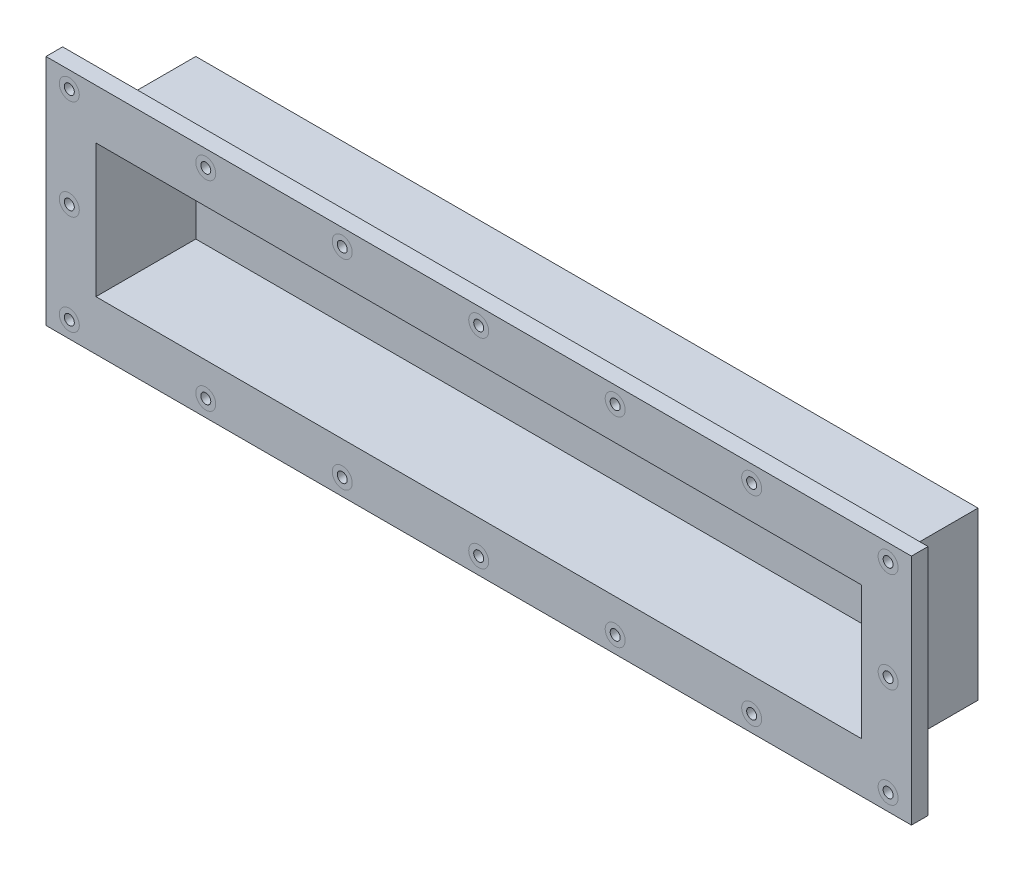
from build123d import *

# Parameters (mm, degrees)
SKETCH_1_W          = 470
SKETCH_1_H          = 100
EXTRUDE_1_DEPTH     = 50
SKETCH_2_W          = 460
SKETCH_2_H          = 80
CUT_EXTRUDE_1_DEPTH = 180
SKETCH_3_W          = 520
SKETCH_3_H          = 140
SKETCH_3_W_2        = 460
SKETCH_3_H_2        = 80
EXTRUDE_2_DEPTH     = 10
SKETCH_4_R          = 6
CUT_EXTRUDE_2_DEPTH = 10
SKETCH_5_R          = 6
SKETCH_5_R_2        = 3
EXTRUDE_3_DEPTH     = 7
EXTRUDE_3_2_DEPTH   = 7
EXTRUDE_3_3_DEPTH   = 7
EXTRUDE_3_4_DEPTH   = 7
EXTRUDE_3_5_DEPTH   = 7
EXTRUDE_3_6_DEPTH   = 7
EXTRUDE_3_7_DEPTH   = 7
EXTRUDE_3_8_DEPTH   = 7
EXTRUDE_3_9_DEPTH   = 7
EXTRUDE_3_10_DEPTH  = 7
EXTRUDE_3_11_DEPTH  = 7
EXTRUDE_3_12_DEPTH  = 7
EXTRUDE_3_13_DEPTH  = 7
EXTRUDE_3_14_DEPTH  = 7
EXTRUDE_3_15_DEPTH  = 7
EXTRUDE_3_16_DEPTH  = 7
SKETCH_6_W          = 470
SKETCH_6_H          = 100
EXTRUDE_4_DEPTH     = 5


with BuildPart() as part:
    # 草图1 → 凸台-拉伸1 (new body)
    with BuildSketch(Plane.XY):
        Rectangle(SKETCH_1_W, SKETCH_1_H)
    extrude(amount=EXTRUDE_1_DEPTH)

    # 草图2 → 切除-拉伸1 (cut)
    with BuildSketch(Plane.XY.offset(50)):
        Rectangle(SKETCH_2_W, SKETCH_2_H)
    extrude(amount=-CUT_EXTRUDE_1_DEPTH, mode=Mode.SUBTRACT)

    # 草图3 → 凸台-拉伸2 (add)
    with BuildSketch(Plane.XY.offset(50)):
        Rectangle(SKETCH_3_W, SKETCH_3_H)
        Rectangle(SKETCH_3_W_2, SKETCH_3_H_2, mode=Mode.SUBTRACT)
    extrude(amount=EXTRUDE_2_DEPTH)

    # 草图4 → 切除-拉伸2 (cut)
    with BuildSketch(Plane.XY.offset(60)):
        with Locations((0, 60)):
            Circle(SKETCH_4_R)
        with Locations((-82, 60)):
            Circle(SKETCH_4_R)
        with Locations((-164, 60)):
            Circle(SKETCH_4_R)
        with Locations((-246, 60)):
            Circle(SKETCH_4_R)
        with Locations(Location((246, 0, 0), (0, 0, 180))):
            Circle(SKETCH_4_R)
        with Locations(Location((246, 60, 0), (0, 0, 180))):
            Circle(SKETCH_4_R)
        with Locations(Location((164, 60, 0), (0, 0, 180))):
            Circle(SKETCH_4_R)
        with Locations(Location((82, 60, 0), (0, 0, 180))):
            Circle(SKETCH_4_R)
        with Locations((-246, 0)):
            Circle(SKETCH_4_R)
        with Locations((82, -60)):
            Circle(SKETCH_4_R)
        with Locations((164, -60)):
            Circle(SKETCH_4_R)
        with Locations((246, -60)):
            Circle(SKETCH_4_R)
        with Locations(Location((-246, -60, 0), (0, 0, 180))):
            Circle(SKETCH_4_R)
        with Locations(Location((-164, -60, 0), (0, 0, 180))):
            Circle(SKETCH_4_R)
        with Locations(Location((-82, -60, 0), (0, 0, 180))):
            Circle(SKETCH_4_R)
        with Locations(Location((0, -60, 0), (0, 0, 180))):
            Circle(SKETCH_4_R)
    extrude(amount=-CUT_EXTRUDE_2_DEPTH, mode=Mode.SUBTRACT)

    # 草图6 → 凸台-拉伸4 (add)
    with BuildSketch(Plane(origin=(0, 0, 0), x_dir=(-1, 0, 0), z_dir=(0, 0, -1))):
        Rectangle(SKETCH_6_W, SKETCH_6_H)
    extrude(amount=EXTRUDE_4_DEPTH)


with BuildPart() as body_2:
    # 草图5 → 凸台-拉伸3 (new body)
    with BuildSketch(Plane.XY.offset(60)):
        with Locations((0, 60)):
            Circle(SKETCH_5_R)
        with Locations((0, 60)):
            Circle(SKETCH_5_R_2, mode=Mode.SUBTRACT)
    extrude(amount=-EXTRUDE_3_DEPTH)


with BuildPart() as body_3:
    # 草图5 → Extrude 3 2 (new body)
    with BuildSketch(Plane.XY.offset(60)):
        with Locations((-82, 60)):
            Circle(SKETCH_5_R)
        with Locations((-82, 60)):
            Circle(SKETCH_5_R_2, mode=Mode.SUBTRACT)
    extrude(amount=-EXTRUDE_3_2_DEPTH)


with BuildPart() as body_4:
    # 草图5 → Extrude 3 3 (new body)
    with BuildSketch(Plane.XY.offset(60)):
        with Locations((-164, 60)):
            Circle(SKETCH_5_R)
        with Locations((-164, 60)):
            Circle(SKETCH_5_R_2, mode=Mode.SUBTRACT)
    extrude(amount=-EXTRUDE_3_3_DEPTH)


with BuildPart() as body_5:
    # 草图5 → Extrude 3 4 (new body)
    with BuildSketch(Plane.XY.offset(60)):
        with Locations((-246, 60)):
            Circle(SKETCH_5_R)
        with Locations((-246, 60)):
            Circle(SKETCH_5_R_2, mode=Mode.SUBTRACT)
    extrude(amount=-EXTRUDE_3_4_DEPTH)


with BuildPart() as body_6:
    # 草图5 → Extrude 3 5 (new body)
    with BuildSketch(Plane.XY.offset(60)):
        with Locations(Location((-246, -60, 0), (0, 0, 180))):
            Circle(SKETCH_5_R)
        with Locations(Location((-246, -60, 0), (0, 0, 180))):
            Circle(SKETCH_5_R_2, mode=Mode.SUBTRACT)
    extrude(amount=-EXTRUDE_3_5_DEPTH)


with BuildPart() as body_7:
    # 草图5 → Extrude 3 6 (new body)
    with BuildSketch(Plane.XY.offset(60)):
        with Locations(Location((-164, -60, 0), (0, 0, 180))):
            Circle(SKETCH_5_R)
        with Locations(Location((-164, -60, 0), (0, 0, 180))):
            Circle(SKETCH_5_R_2, mode=Mode.SUBTRACT)
    extrude(amount=-EXTRUDE_3_6_DEPTH)


with BuildPart() as body_8:
    # 草图5 → Extrude 3 7 (new body)
    with BuildSketch(Plane.XY.offset(60)):
        with Locations(Location((-82, -60, 0), (0, 0, 180))):
            Circle(SKETCH_5_R)
        with Locations(Location((-82, -60, 0), (0, 0, 180))):
            Circle(SKETCH_5_R_2, mode=Mode.SUBTRACT)
    extrude(amount=-EXTRUDE_3_7_DEPTH)


with BuildPart() as body_9:
    # 草图5 → Extrude 3 8 (new body)
    with BuildSketch(Plane.XY.offset(60)):
        with Locations(Location((0, -60, 0), (0, 0, 180))):
            Circle(SKETCH_5_R)
        with Locations(Location((0, -60, 0), (0, 0, 180))):
            Circle(SKETCH_5_R_2, mode=Mode.SUBTRACT)
    extrude(amount=-EXTRUDE_3_8_DEPTH)


with BuildPart() as body_10:
    # 草图5 → Extrude 3 9 (new body)
    with BuildSketch(Plane.XY.offset(60)):
        with Locations((82, -60)):
            Circle(SKETCH_5_R)
        with Locations((82, -60)):
            Circle(SKETCH_5_R_2, mode=Mode.SUBTRACT)
    extrude(amount=-EXTRUDE_3_9_DEPTH)


with BuildPart() as body_11:
    # 草图5 → Extrude 3 10 (new body)
    with BuildSketch(Plane.XY.offset(60)):
        with Locations((164, -60)):
            Circle(SKETCH_5_R)
        with Locations((164, -60)):
            Circle(SKETCH_5_R_2, mode=Mode.SUBTRACT)
    extrude(amount=-EXTRUDE_3_10_DEPTH)


with BuildPart() as body_12:
    # 草图5 → Extrude 3 11 (new body)
    with BuildSketch(Plane.XY.offset(60)):
        with Locations((246, -60)):
            Circle(SKETCH_5_R)
        with Locations((246, -60)):
            Circle(SKETCH_5_R_2, mode=Mode.SUBTRACT)
    extrude(amount=-EXTRUDE_3_11_DEPTH)


with BuildPart() as body_13:
    # 草图5 → Extrude 3 12 (new body)
    with BuildSketch(Plane.XY.offset(60)):
        with Locations(Location((246, 0, 0), (0, 0, 180))):
            Circle(SKETCH_5_R)
        with Locations(Location((246, 0, 0), (0, 0, 180))):
            Circle(SKETCH_5_R_2, mode=Mode.SUBTRACT)
    extrude(amount=-EXTRUDE_3_12_DEPTH)


with BuildPart() as body_14:
    # 草图5 → Extrude 3 13 (new body)
    with BuildSketch(Plane.XY.offset(60)):
        with Locations(Location((246, 60, 0), (0, 0, 180))):
            Circle(SKETCH_5_R)
        with Locations(Location((246, 60, 0), (0, 0, 180))):
            Circle(SKETCH_5_R_2, mode=Mode.SUBTRACT)
    extrude(amount=-EXTRUDE_3_13_DEPTH)


with BuildPart() as body_15:
    # 草图5 → Extrude 3 14 (new body)
    with BuildSketch(Plane.XY.offset(60)):
        with Locations(Location((164, 60, 0), (0, 0, 180))):
            Circle(SKETCH_5_R)
        with Locations(Location((164, 60, 0), (0, 0, 180))):
            Circle(SKETCH_5_R_2, mode=Mode.SUBTRACT)
    extrude(amount=-EXTRUDE_3_14_DEPTH)


with BuildPart() as body_16:
    # 草图5 → Extrude 3 15 (new body)
    with BuildSketch(Plane.XY.offset(60)):
        with Locations(Location((82, 60, 0), (0, 0, 180))):
            Circle(SKETCH_5_R)
        with Locations(Location((82, 60, 0), (0, 0, 180))):
            Circle(SKETCH_5_R_2, mode=Mode.SUBTRACT)
    extrude(amount=-EXTRUDE_3_15_DEPTH)


with BuildPart() as body_17:
    # 草图5 → Extrude 3 16 (new body)
    with BuildSketch(Plane.XY.offset(60)):
        with Locations((-246, 0)):
            Circle(SKETCH_5_R)
        with Locations((-246, 0)):
            Circle(SKETCH_5_R_2, mode=Mode.SUBTRACT)
    extrude(amount=-EXTRUDE_3_16_DEPTH)


solid = Compound([part.part, body_2.part, body_3.part, body_4.part, body_5.part, body_6.part, body_7.part, body_8.part, body_9.part, body_10.part, body_11.part, body_12.part, body_13.part, body_14.part, body_15.part, body_16.part, body_17.part])
